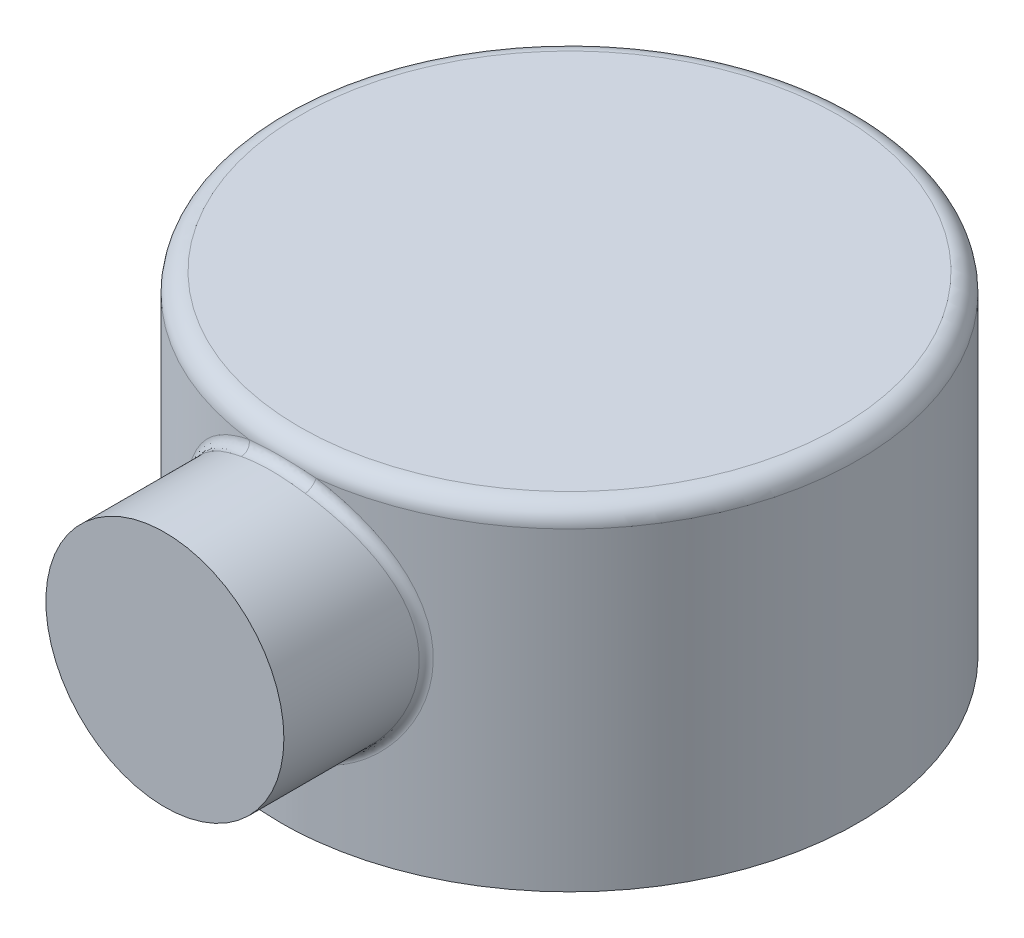
from build123d import *

# Parameters (mm, degrees)
SKETCH1_R           = 60.675
BOSS_EXTRUDE1_DEPTH = 70
SKETCH2_R           = 25
BOSS_EXTRUDE2_DEPTH = 85
FILLET1_R           = 4
FILLET2_R           = 2


with BuildPart() as part:
    # Sketch1 → Boss-Extrude1 (new body)
    with BuildSketch(Plane(origin=(0, 0, 0), x_dir=(1, 0, 0), z_dir=(0, 1, 0))):
        with Locations(Location((0, 0, 0), (0, 0, 270))):
            Circle(SKETCH1_R)
    extrude(amount=BOSS_EXTRUDE1_DEPTH)

    # Sketch2 → Boss-Extrude2 (add)
    with BuildSketch(Plane.XY):
        with Locations(Location((0, 40, 0), (0, 0, 180))):
            Circle(SKETCH2_R)
    extrude(amount=BOSS_EXTRUDE2_DEPTH)

    # Fillet1
    fillet1_edges = [part.edges().sort_by_distance(p)[0] for p in [
        (0, 70, -60.675),
    ]]
    fillet(fillet1_edges, radius=FILLET1_R)

    # Fillet2
    fillet2_edges = [part.edges().sort_by_distance(p)[0] for p in [
        (25, 40, 55.285220674),
    ]]
    fillet(fillet2_edges, radius=FILLET2_R)


solid = part.part
